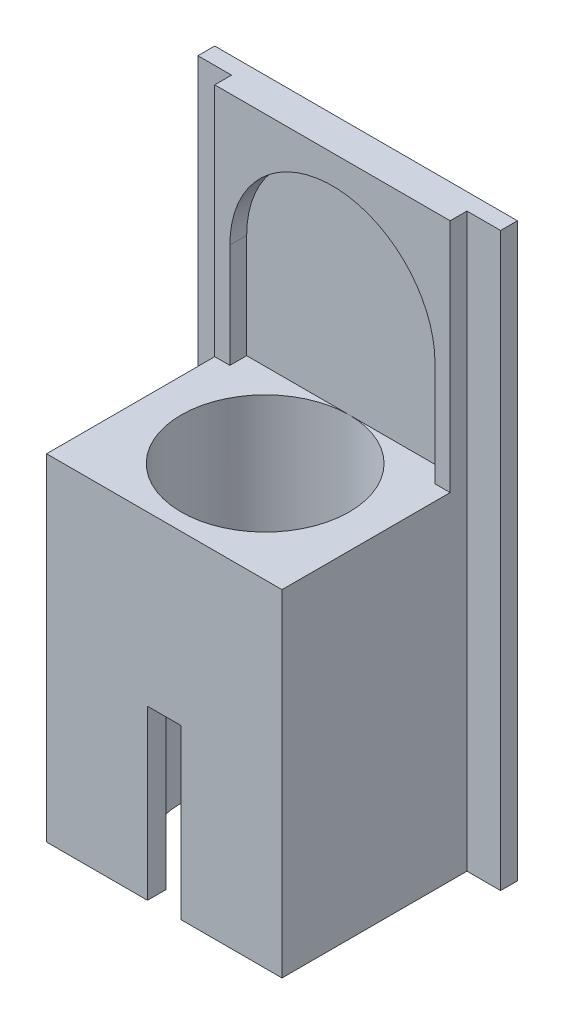
from build123d import *

# Parameters (mm, degrees)
ESQUISSE1_W                  = 90
ESQUISSE1_H                  = 170
BOSS_EXTRU_1_DEPTH           = 5
ESQUISSE2_W                  = 70
ESQUISSE2_H                  = 100
BOSS_EXTRU_2_DEPTH           = 55
ENL_V_MAT_EXTRU_2_REACH      = 766.465
ESQUISSE4_R                  = 25
ENL_V_MAT_EXTRU_3_REACH      = 1014.096
ENL_V_MAT_EXTRU_3_END_RADIUS = 25
ESQUISSE5_W                  = 10
ESQUISSE5_H                  = 50
ESQUISSE6_W                  = 70
ESQUISSE6_H                  = 70
BOSS_EXTRU_3_DEPTH           = 5
ENL_V_MAT_EXTRU_4_DEPTH      = 5


with BuildPart() as part:
    # Esquisse1 → Boss.-Extru.1 (new body)
    with BuildSketch(Plane.XY):
        with Locations((-710.517990966, -585.769230769)):
            Rectangle(ESQUISSE1_W, ESQUISSE1_H)
    extrude(amount=BOSS_EXTRU_1_DEPTH)

    # Esquisse2 → Boss.-Extru.2 (add)
    with BuildSketch(Plane.XY.offset(5)):
        with Locations((-710.517990966, -620.769230769)):
            Rectangle(ESQUISSE2_W, ESQUISSE2_H)
    extrude(amount=BOSS_EXTRU_2_DEPTH)

    # Esquisse4 → Enlèv. mat.-Extru.2 (cut, up to next)
    with BuildSketch(Plane(origin=(0, -570.769230769, 0), x_dir=(1, 0, 0), z_dir=(0, 1, 0)), mode=Mode.PRIVATE) as enl_v_mat_extru_2_sk1:
        with Locations(Location((-710.517990966, -30, 0), (0, 0, 270))):
            Circle(ESQUISSE4_R)
    enl_v_mat_extru_2_tool1 = extrude(enl_v_mat_extru_2_sk1.sketch, amount=-ENL_V_MAT_EXTRU_2_REACH, mode=Mode.PRIVATE) & part.part
    add(enl_v_mat_extru_2_tool1.solids().sort_by_distance((-710.517991, -570.769231, 30))[0], mode=Mode.SUBTRACT)

    # Enlèv. mat.-Extru.3: up to this cylinder (the profile starts outside it)
    enl_v_mat_extru_3_end = Plane(origin=(-710.517990966, -645.769231, 30), z_dir=(0, 1, 0)) * Cylinder(ENL_V_MAT_EXTRU_3_END_RADIUS, 2079.192, mode=Mode.PRIVATE)
    # Esquisse5 → Enlèv. mat.-Extru.3 (cut, up to the surface)
    with BuildSketch(Plane.XY.offset(60), mode=Mode.PRIVATE) as enl_v_mat_extru_3_sk1:
        with Locations((-710.517990966, -645.769230769)):
            Rectangle(ESQUISSE5_W, ESQUISSE5_H)
    enl_v_mat_extru_3_tool1 = extrude(enl_v_mat_extru_3_sk1.sketch, amount=-ENL_V_MAT_EXTRU_3_REACH, mode=Mode.PRIVATE) - enl_v_mat_extru_3_end
    add(enl_v_mat_extru_3_tool1.solids().sort_by_distance((-710.517991, -645.769231, 60))[0], mode=Mode.SUBTRACT)

    # Esquisse6 → Boss.-Extru.3 (add)
    with BuildSketch(Plane.XY.offset(5)):
        with Locations((-710.517990966, -535.769230769)):
            Rectangle(ESQUISSE6_W, ESQUISSE6_H)
    extrude(amount=BOSS_EXTRU_3_DEPTH)

    # Esquisse7 → Enlèv. mat.-Extru.4 (cut)
    with BuildSketch(Plane.XY.offset(10)):
        with BuildLine():
            Line((-741.017990966, -539.769230769), (-741.017990966, -570.769230769))
            Line((-741.017990966, -570.769230769), (-680.017990966, -570.769230769))
            Line((-680.017990966, -570.769230769), (-680.017990966, -539.769230769))
            ThreePointArc((-680.017990966, -539.769230769), (-710.517990966, -509.269230769), (-741.017990966, -539.769230769))
        make_face()
    extrude(amount=-ENL_V_MAT_EXTRU_4_DEPTH, mode=Mode.SUBTRACT)


solid = part.part
